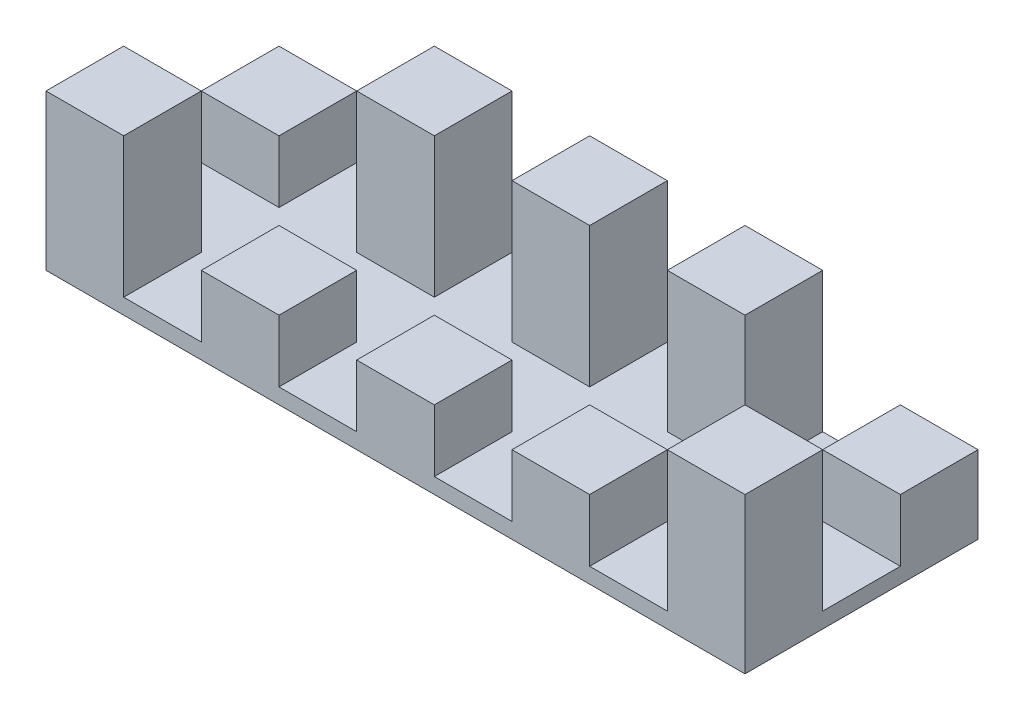
from build123d import *

# Parameters (mm, degrees)
BOSS_EXTRUDE3_DEPTH = 10
SKETCH2_5_W         = 50
SKETCH2_5_H         = 50
BOSS_EXTRUDE4_DEPTH = 100
SKETCH2_6_W         = 50
SKETCH2_6_H         = 50
BOSS_EXTRUDE5_DEPTH = 50


with BuildPart() as part:
    # Sketch2 → Boss-Extrude3 (new body)
    with BuildSketch(Plane(origin=(0, 0, 0), x_dir=(1, 0, 0), z_dir=(0, 1, 0))):
        Polygon((100, 100), (100, 150), (50, 150), (50, 100), (0, 100), (0, 50), (50, 50), (50, 0), (100, 0), (100, 50), (150, 50), (150, 0), (200, 0), (200, 50), (250, 50), (250, 0), (300, 0), (300, 50), (350, 50), (350, 0), (400, 0), (400, 50), (450, 50), (450, 100), (400, 100), (400, 150), (350, 150), (350, 100), (300, 100), (300, 150), (250, 150), (250, 100), (200, 100), (200, 150), (150, 150), (150, 100), align=None)
    extrude(amount=BOSS_EXTRUDE3_DEPTH)

    # Sketch2<5> → Boss-Extrude4 (add)
    with BuildSketch(Plane(origin=(0, 0, 0), x_dir=(1, 0, 0), z_dir=(0, 1, 0))):
        with Locations((125, 125)):
            Rectangle(SKETCH2_5_W, SKETCH2_5_H)
        with Locations((225, 125)):
            Rectangle(SKETCH2_5_W, SKETCH2_5_H)
        with Locations((325, 125)):
            Rectangle(SKETCH2_5_W, SKETCH2_5_H)
        with Locations((25, 25)):
            Rectangle(SKETCH2_5_W, SKETCH2_5_H)
        with Locations((425, 25)):
            Rectangle(SKETCH2_5_W, SKETCH2_5_H)
    extrude(amount=BOSS_EXTRUDE4_DEPTH)

    # Sketch2<6> → Boss-Extrude5 (add)
    with BuildSketch(Plane(origin=(0, 0, 0), x_dir=(1, 0, 0), z_dir=(0, 1, 0))):
        with Locations((25, 125)):
            Rectangle(SKETCH2_6_W, SKETCH2_6_H)
        with Locations((425, 125)):
            Rectangle(SKETCH2_6_W, SKETCH2_6_H)
        with Locations((125, 25)):
            Rectangle(SKETCH2_6_W, SKETCH2_6_H)
        with Locations((225, 25)):
            Rectangle(SKETCH2_6_W, SKETCH2_6_H)
        with Locations((325, 25)):
            Rectangle(SKETCH2_6_W, SKETCH2_6_H)
    extrude(amount=BOSS_EXTRUDE5_DEPTH)


solid = part.part
